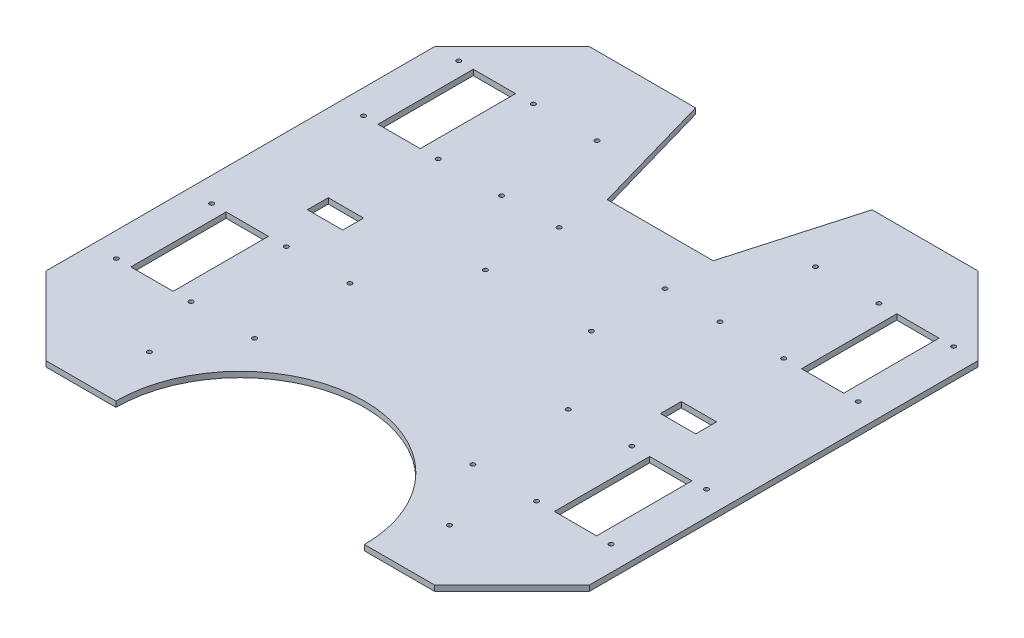
from build123d import *

# Parameters (mm, degrees)
SKETCH_1_R      = 1.55
SKETCH_1_W      = 30.4
SKETCH_1_H      = 68.58
SKETCH_1_W_2    = 25.4
SKETCH_1_H_2    = 15
EXTRUDE_1_DEPTH = 4


with BuildPart() as part:
    # 草图1 → 凸台-拉伸1 (new body)
    with BuildSketch(Plane(origin=(0, 0, 0), x_dir=(1, 0, 0), z_dir=(0, 1, 0))):
        with BuildLine():
            Line((-212.783006705, -92.69108054), (-212.783006705, 186.70891946))
            Line((-212.783006705, 186.70891946), (-156.903006705, 242.58891946))
            Line((-156.903006705, 242.58891946), (-80.703006705, 242.58891946))
            Line((-80.703006705, 242.58891946), (-55.303006705, 153.68891946))
            Line((-55.303006705, 153.68891946), (20.896993295, 153.68891946))
            Line((20.896993295, 153.68891946), (46.296993295, 242.58891946))
            Line((46.296993295, 242.58891946), (122.496993295, 242.58891946))
            Line((122.496993295, 242.58891946), (178.376993295, 186.70891946))
            Line((178.376993295, 186.70891946), (178.376993295, -92.69108054))
            Line((178.376993295, -92.69108054), (122.496993295, -148.57108054))
            Line((122.496993295, -148.57108054), (72.204993295, -148.57108054))
            ThreePointArc((72.204993295, -148.57108054), (-17.203006705, -59.16308054), (-106.611006705, -148.57108054))
            Line((-106.611006705, -148.57108054), (-156.903006705, -148.57108054))
            Line((-156.903006705, -148.57108054), (-212.783006705, -92.69108054))
        make_face()
        with Locations(Location((-141.489006705, 186.70891946, 0), (0, 0, 270))):
            Circle(SKETCH_1_R, mode=Mode.SUBTRACT)
        with Locations(Location((20.896993295, 66.00891946, 0), (0, 0, 270))):
            Circle(SKETCH_1_R, mode=Mode.SUBTRACT)
        with Locations(Location((90.746993295, -105.99108054, 0), (0, 0, 270))):
            Circle(SKETCH_1_R, mode=Mode.SUBTRACT)
        with Locations(Location((-125.153006705, -105.99108054, 0), (0, 0, 270))):
            Circle(SKETCH_1_R, mode=Mode.SUBTRACT)
        with Locations(Location((-141.489006705, 118.12891946, 0), (0, 0, 270))):
            Circle(SKETCH_1_R, mode=Mode.SUBTRACT)
        with Locations(Location((-95.769006705, 118.12891946, 0), (0, 0, 270))):
            Circle(SKETCH_1_R, mode=Mode.SUBTRACT)
        with Locations(Location((107.082993295, 118.12891946, 0), (0, 0, 270))):
            Circle(SKETCH_1_R, mode=Mode.SUBTRACT)
        with Locations(Location((-141.489006705, 8.90891946, 0), (0, 0, 270))):
            Circle(SKETCH_1_R, mode=Mode.SUBTRACT)
        with Locations(Location((61.362993295, 118.12891946, 0), (0, 0, 270))):
            Circle(SKETCH_1_R, mode=Mode.SUBTRACT)
        with Locations(Location((61.362993295, 186.70891946, 0), (0, 0, 270))):
            Circle(SKETCH_1_R, mode=Mode.SUBTRACT)
        with Locations(Location((-141.489006705, -59.67108054, 0), (0, 0, 270))):
            Circle(SKETCH_1_R, mode=Mode.SUBTRACT)
        with Locations(Location((-95.769006705, -59.67108054, 0), (0, 0, 270))):
            Circle(SKETCH_1_R, mode=Mode.SUBTRACT)
        with Locations(Location((-95.769006705, 186.70891946, 0), (0, 0, 270))):
            Circle(SKETCH_1_R, mode=Mode.SUBTRACT)
        with Locations(Location((107.082993295, -59.67108054, 0), (0, 0, 270))):
            Circle(SKETCH_1_R, mode=Mode.SUBTRACT)
        with Locations(Location((61.362993295, -59.67108054, 0), (0, 0, 270))):
            Circle(SKETCH_1_R, mode=Mode.SUBTRACT)
        with Locations(Location((107.082993295, 186.70891946, 0), (0, 0, 270))):
            Circle(SKETCH_1_R, mode=Mode.SUBTRACT)
        with Locations(Location((160.796993295, 186.70891946, 0), (0, 0, 270))):
            Circle(SKETCH_1_R, mode=Mode.SUBTRACT)
        with Locations(Location((-195.203006705, 118.12891946, 0), (0, 0, 270))):
            Circle(SKETCH_1_R, mode=Mode.SUBTRACT)
        with Locations(Location((-195.203006705, 186.70891946, 0), (0, 0, 270))):
            Circle(SKETCH_1_R, mode=Mode.SUBTRACT)
        with Locations(Location((160.796993295, 8.90891946, 0), (0, 0, 270))):
            Circle(SKETCH_1_R, mode=Mode.SUBTRACT)
        with Locations(Location((-55.303006705, 66.00891946, 0), (0, 0, 270))):
            Circle(SKETCH_1_R, mode=Mode.SUBTRACT)
        with Locations(Location((20.896993295, 119.00891946, 0), (0, 0, 270))):
            Circle(SKETCH_1_R, mode=Mode.SUBTRACT)
        with Locations(Location((-55.303006705, 119.00891946, 0), (0, 0, 270))):
            Circle(SKETCH_1_R, mode=Mode.SUBTRACT)
        with Locations(Location((160.796993295, 118.12891946, 0), (0, 0, 270))):
            Circle(SKETCH_1_R, mode=Mode.SUBTRACT)
        with Locations(Location((107.082993295, 8.90891946, 0), (0, 0, 270))):
            Circle(SKETCH_1_R, mode=Mode.SUBTRACT)
        with Locations(Location((61.362993295, 8.90891946, 0), (0, 0, 270))):
            Circle(SKETCH_1_R, mode=Mode.SUBTRACT)
        with Locations(Location((-95.769006705, 8.90891946, 0), (0, 0, 270))):
            Circle(SKETCH_1_R, mode=Mode.SUBTRACT)
        with Locations(Location((-195.203006705, 8.90891946, 0), (0, 0, 270))):
            Circle(SKETCH_1_R, mode=Mode.SUBTRACT)
        with Locations(Location((-195.203006705, -59.67108054, 0), (0, 0, 270))):
            Circle(SKETCH_1_R, mode=Mode.SUBTRACT)
        with Locations(Location((160.796993295, -59.67108054, 0), (0, 0, 270))):
            Circle(SKETCH_1_R, mode=Mode.SUBTRACT)
        with Locations((-169.563006705, -25.38108054)):
            Rectangle(SKETCH_1_W, SKETCH_1_H, mode=Mode.SUBTRACT)
        with Locations((135.156993295, 152.41891946)):
            Rectangle(SKETCH_1_W, SKETCH_1_H, mode=Mode.SUBTRACT)
        with Locations((135.156993295, -25.38108054)):
            Rectangle(SKETCH_1_W, SKETCH_1_H, mode=Mode.SUBTRACT)
        with Locations((-169.563006705, 152.41891946)):
            Rectangle(SKETCH_1_W, SKETCH_1_H, mode=Mode.SUBTRACT)
        with Locations((-144.203006705, 47.00891946)):
            Rectangle(SKETCH_1_W_2, SKETCH_1_H_2, mode=Mode.SUBTRACT)
        with Locations((109.796993295, 47.00891946)):
            Rectangle(SKETCH_1_W_2, SKETCH_1_H_2, mode=Mode.SUBTRACT)
    extrude(amount=EXTRUDE_1_DEPTH)


solid = part.part
